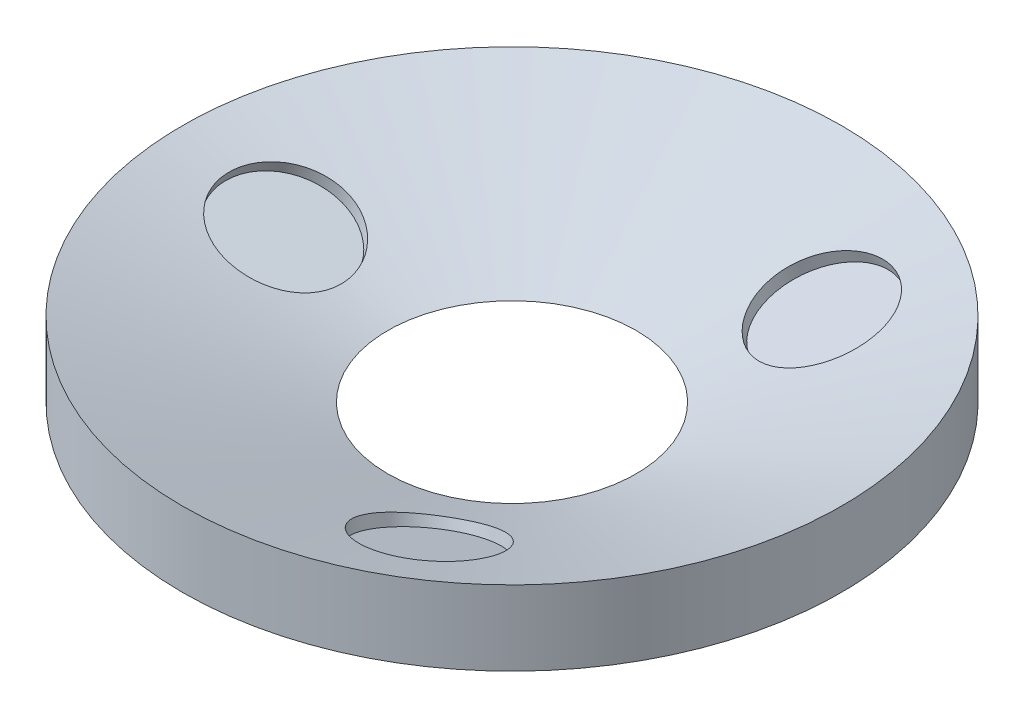
from build123d import *

# Parameters (mm, degrees)
TAGLIO_ESTRUSIONE5_START    = -2
SCHIZZO2_R                  = 12.5
TAGLIO_ESTRUSIONE5_DEPTH    = 12
RIPETIZIONECIRCOLARE1_COUNT = 3


with BuildPart() as part:
    # Schizzo1 → Rivoluzione1 (revolve)
    with BuildSketch(Plane.XY, mode=Mode.PRIVATE) as rivoluzione1_sk:
        Polygon((-69, 15.650720073), (-69, 0), (-26, 0), align=None)
    revolve(rivoluzione1_sk.sketch.rotate(Axis((0, 0, 0), (0, 1, 0)), 270), axis=Axis((0, 0, 0), (0, 1, 0)))

    # Schizzo2 → Taglio-Estrusione5 (cut)
    with BuildSketch(Plane(origin=(-3.041422239, -8.356238926, 6.34e-07), x_dir=(-0.9396926207859105, 0.3420201433256629, 0), z_dir=(0.34202014332566205, 0.9396926207859082, -7.133604585251575e-08)).offset(TAGLIO_ESTRUSIONE5_START)):
        with Locations(Location((47.311830249, -6.33e-07, 0), (0, 0, 276.586310477))):
            Circle(SCHIZZO2_R)
    taglio_estrusione5 = extrude(amount=TAGLIO_ESTRUSIONE5_DEPTH, mode=Mode.SUBTRACT)

    # RipetizioneCircolare1: Taglio-Estrusione5 ×3 about axis
    ripetizionecircolare1_axis = Axis((0, 0, 0), (0, 1, 0))
    for i in range(1, RIPETIZIONECIRCOLARE1_COUNT):
        add(taglio_estrusione5.rotate(ripetizionecircolare1_axis, i * 360 / RIPETIZIONECIRCOLARE1_COUNT), mode=Mode.SUBTRACT)


solid = part.part
